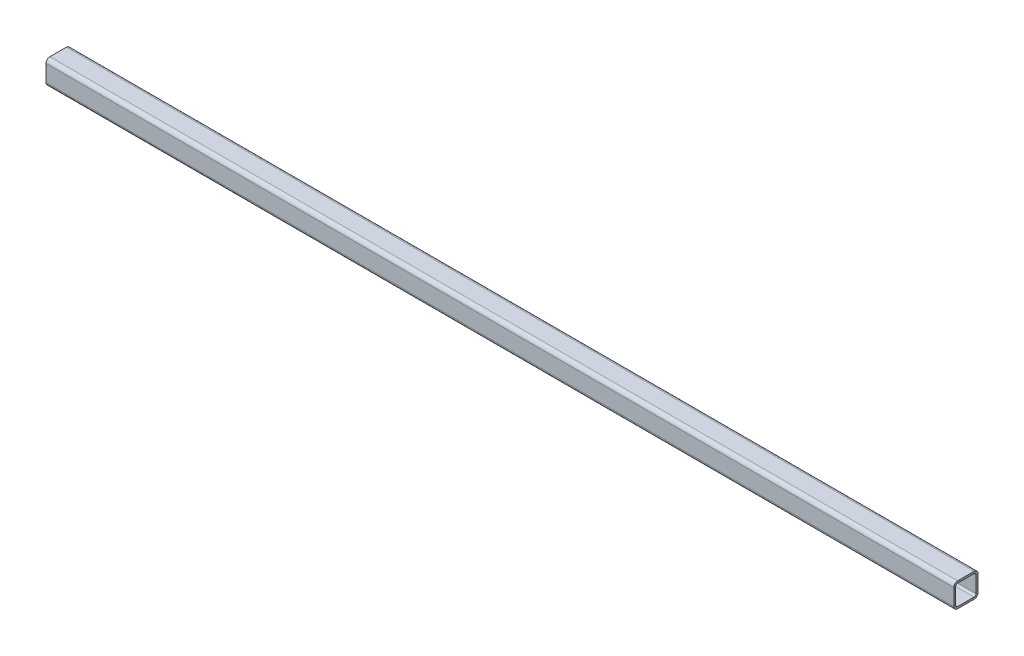
from build123d import *

# Parameters (mm, degrees)
TUBE_SQUARE_40_X_40_X_3_2_7_DEPTH = 1500


with BuildPart() as part:
    # Sketch12 → Tube (square) 40 X 40 X 3.2(7) (new body)
    with BuildSketch(Plane(origin=(0, 0, 0), x_dir=(0, 0, -1), z_dir=(1, 0, 0))):
        with BuildLine():
            Line((-13.6, -20), (13.6, -20))
            ThreePointArc((13.6, -20), (18.1254834, -18.1254834), (20, -13.6))
            Line((20, -13.6), (20, 13.6))
            ThreePointArc((20, 13.6), (18.1254834, 18.1254834), (13.6, 20))
            Line((13.6, 20), (-13.6, 20))
            ThreePointArc((-13.6, 20), (-18.1254834, 18.1254834), (-20, 13.6))
            Line((-20, 13.6), (-20, -13.6))
            ThreePointArc((-20, -13.6), (-18.1254834, -18.1254834), (-13.6, -20))
        make_face()
        with BuildLine():
            Line((-13.6, -16.8), (13.6, -16.8))
            ThreePointArc((13.6, -16.8), (15.8627417, -15.8627417), (16.8, -13.6))
            Line((16.8, -13.6), (16.8, 13.6))
            ThreePointArc((16.8, 13.6), (15.8627417, 15.8627417), (13.6, 16.8))
            Line((13.6, 16.8), (-13.6, 16.8))
            ThreePointArc((-13.6, 16.8), (-15.8627417, 15.8627417), (-16.8, 13.6))
            Line((-16.8, 13.6), (-16.8, -13.6))
            ThreePointArc((-16.8, -13.6), (-15.8627417, -15.8627417), (-13.6, -16.8))
        make_face(mode=Mode.SUBTRACT)
    extrude(amount=TUBE_SQUARE_40_X_40_X_3_2_7_DEPTH)


solid = part.part
